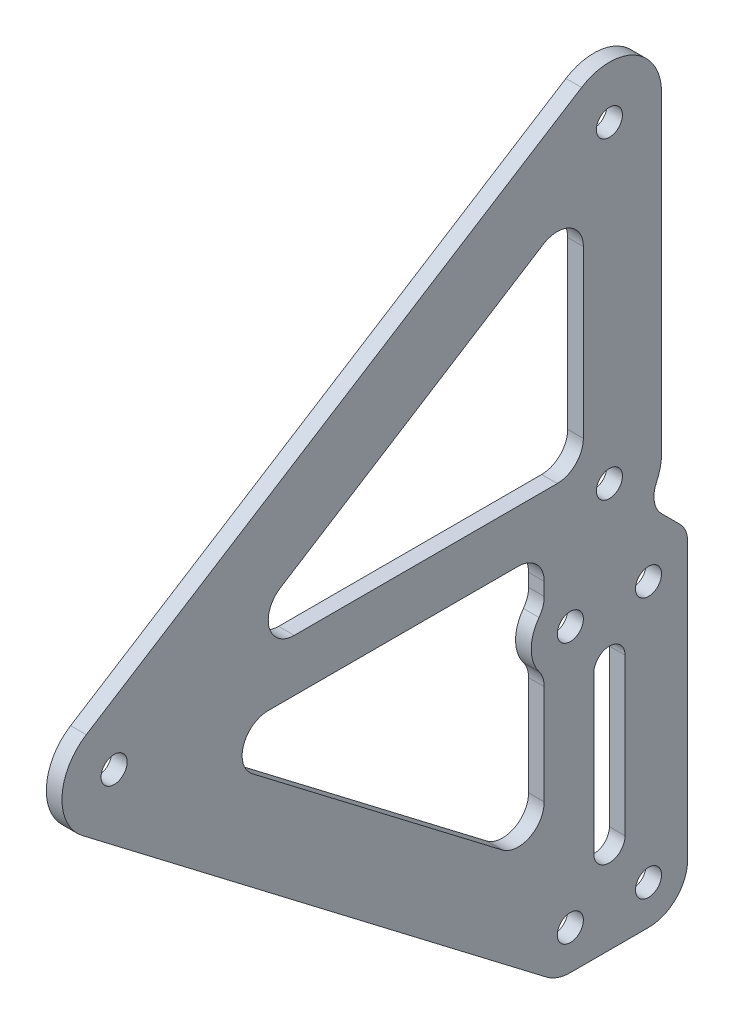
from build123d import *

# Parameters (mm, degrees)
SKETCH_1_R      = 2.5
EXTRUDE_1_DEPTH = 3


with BuildPart() as part:
    # 草图1 → 凸台-拉伸1 (new body)
    with BuildSketch(Plane(origin=(0, 0, 0), x_dir=(0, 0, -1), z_dir=(1, 0, 0))):
        with BuildLine():
            Line((-5.339929914, 8.45488903), (89.660070086, 68.45488903))
            ThreePointArc((89.660070086, 68.45488903), (99.827043653, 68.757833612), (105, 60))
            Line((105, 60), (105, 0))
            ThreePointArc((105, 0), (104.752868622, -2.209423827), (104.023689271, -4.309644063))
            ThreePointArc((104.023689271, -4.309644063), (103.607541108, -7.309975988), (105, -10))
            Line((105, -10), (108.535533906, -13.535533906))
            ThreePointArc((108.535533906, -13.535533906), (109.619397663, -15.15765065), (110, -17.071067812))
            Line((110, -17.071067812), (110, -70))
            ThreePointArc((110, -70), (107.803300859, -75.303300859), (102.5, -77.5))
            Line((102.5, -77.5), (87.5, -77.5))
            ThreePointArc((87.5, -77.5), (85.096555547, -77.10446724), (82.946615365, -75.959587936))
            Line((82.946615365, -75.959587936), (-6.071179513, -7.946117248))
            ThreePointArc((-6.071179513, -7.946117248), (-9.990075391, 0.44541405), (-5.339929914, 8.45488903))
        make_face()
        Circle(SKETCH_1_R, mode=Mode.SUBTRACT)
        with Locations((95, 0)):
            Circle(SKETCH_1_R, mode=Mode.SUBTRACT)
        with Locations((95, 60)):
            Circle(SKETCH_1_R, mode=Mode.SUBTRACT)
        with Locations((87.5, -20)):
            Circle(SKETCH_1_R, mode=Mode.SUBTRACT)
        with Locations((102.5, -20)):
            Circle(SKETCH_1_R, mode=Mode.SUBTRACT)
        with Locations((87.5, -70)):
            Circle(SKETCH_1_R, mode=Mode.SUBTRACT)
        with Locations((102.5, -70)):
            Circle(SKETCH_1_R, mode=Mode.SUBTRACT)
        with BuildLine():
            Line((82.330035043, 46.084178697), (31.890205922, 14.227444515))
            ThreePointArc((31.890205922, 14.227444515), (29.757191461, 8.610255883), (34.560170879, 5))
            Line((34.560170879, 5), (85, 5))
            ThreePointArc((85, 5), (88.535533906, 6.464466094), (90, 10))
            Line((90, 10), (90, 41.856734182))
            ThreePointArc((90, 41.856734182), (87.413521827, 46.235650988), (82.330035043, 46.084178697))
        make_face(mode=Mode.SUBTRACT)
        with BuildLine():
            Line((29.559523335, -5), (77.5, -5))
            ThreePointArc((77.5, -5), (81.035533906, -6.464466094), (82.5, -10))
            Line((82.5, -10), (82.5, -12.5))
            ThreePointArc((82.5, -12.5), (82.24341649, -14.08113883), (81.5, -15.5))
            ThreePointArc((81.5, -15.5), (80, -20), (81.5, -24.5))
            ThreePointArc((81.5, -24.5), (82.24341649, -25.91886117), (82.5, -27.5))
            Line((82.5, -27.5), (82.5, -46.628611267))
            ThreePointArc((82.5, -46.628611267), (79.716083394, -51.110683822), (74.464410244, -50.601669891))
            Line((74.464410244, -50.601669891), (26.523933579, -13.973058624))
            ThreePointArc((26.523933579, -13.973058624), (24.823211842, -8.397703698), (29.559523335, -5))
        make_face(mode=Mode.SUBTRACT)
        with BuildLine():
            Line((98, -30), (98, -60))
            ThreePointArc((98, -60), (95, -63), (92, -60))
            Line((92, -60), (92, -30))
            ThreePointArc((92, -30), (95, -27), (98, -30))
        make_face(mode=Mode.SUBTRACT)
    extrude(amount=EXTRUDE_1_DEPTH)


solid = part.part
